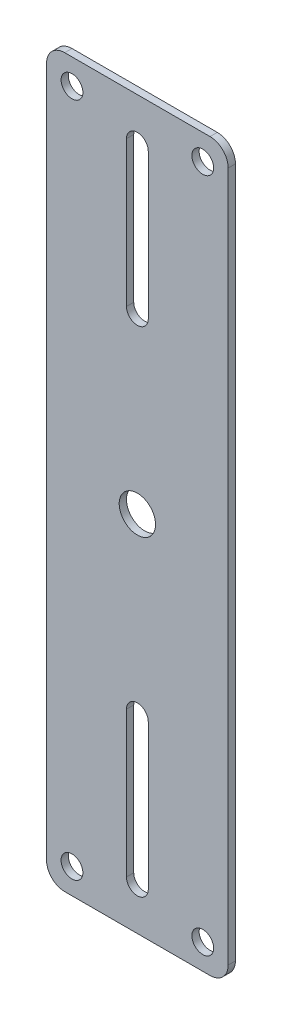
from build123d import *

# Parameters (mm, degrees)
SCHIZZO1_W                   = 50
SCHIZZO1_H                   = 100
SCHIZZO1_R                   = 3
ESTRUSIONE_ESTRUSIONE1_DEPTH = 2
RACCORDO3_R                  = 5
RACCORDO4_R                  = 5
SCHIZZO3_R                   = 5
TAGLIO_ESTRUSIONE1_DEPTH     = 104.097041665


with BuildPart() as part:
    # Schizzo1 → Estrusione-Estrusione1 (new body)
    with BuildSketch(Plane.XY):
        with Locations((0, 50)):
            Rectangle(SCHIZZO1_W, SCHIZZO1_H)
        with Locations((-18, 93)):
            Circle(SCHIZZO1_R, mode=Mode.SUBTRACT)
        with Locations((18, 93)):
            Circle(SCHIZZO1_R, mode=Mode.SUBTRACT)
        with BuildLine():
            Line((-3, 88), (-3, 48))
            ThreePointArc((-3, 48), (0, 45), (3, 48))
            Line((3, 48), (3, 88))
            ThreePointArc((3, 88), (0, 91), (-3, 88))
        make_face(mode=Mode.SUBTRACT)
    extrude(amount=ESTRUSIONE_ESTRUSIONE1_DEPTH)

    # Raccordo3
    raccordo3_edges = [part.edges().sort_by_distance(p)[0] for p in [
        (25, 100, 1),
    ]]
    fillet(raccordo3_edges, radius=RACCORDO3_R)

    # Raccordo4
    raccordo4_edges = [part.edges().sort_by_distance(p)[0] for p in [
        (-25, 100, 1),
    ]]
    fillet(raccordo4_edges, radius=RACCORDO4_R)

    # Specchia1: part across plane


with BuildPart() as part_1:
    add(part.part)
    add(part.part.mirror(Plane(origin=(-25, 0, 2), x_dir=(0, 0, 1), z_dir=(0, 1, 0))))

    # Schizzo3 → Taglio-Estrusione1 (cut, through all)
    with BuildSketch(Plane.XY.offset(2)):
        Circle(SCHIZZO3_R)
    extrude(amount=-TAGLIO_ESTRUSIONE1_DEPTH, mode=Mode.SUBTRACT)


solid = part_1.part
